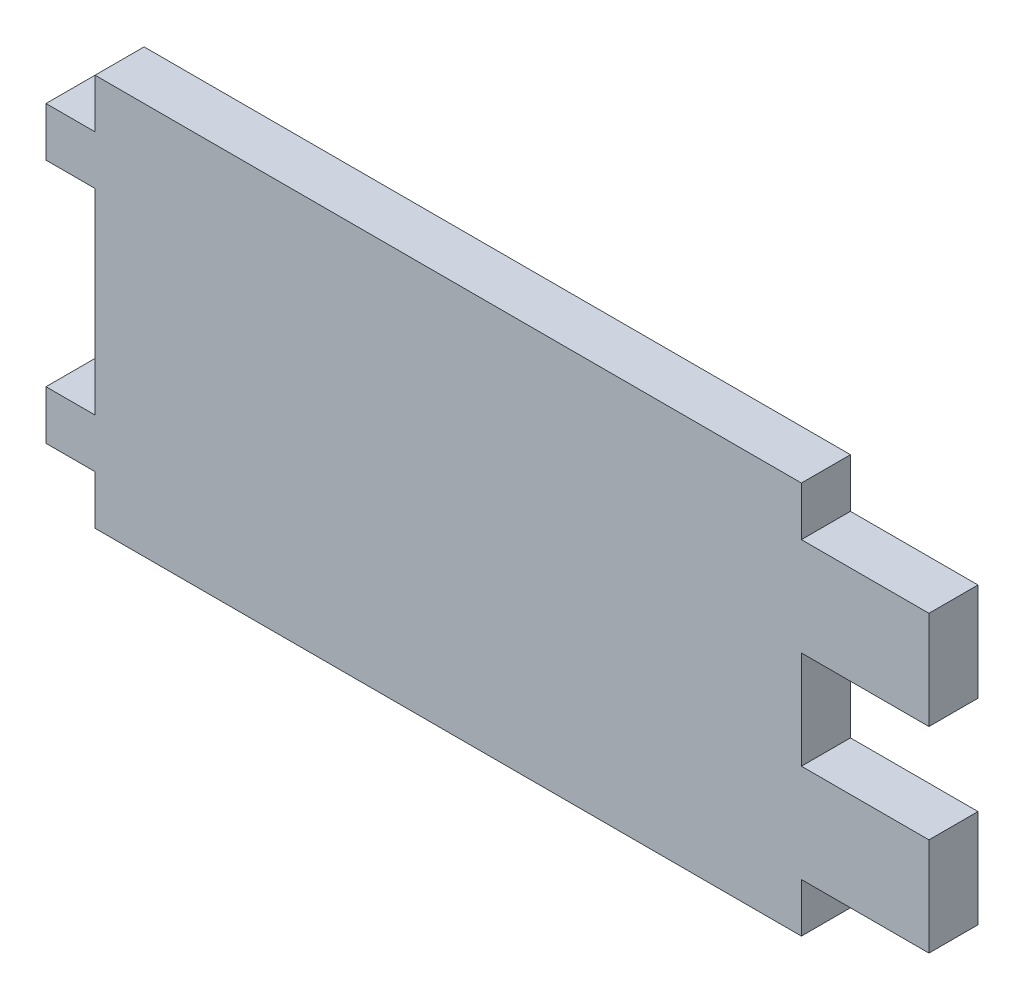
from build123d import *

# Parameters (mm, degrees)
BOSS_EXTRU_1_DEPTH = 5


with BuildPart() as part:
    # Esquisse1 → Boss.-Extru.1 (new body)
    with BuildSketch(Plane.XY):
        Polygon((0, 0), (72, 0), (72, 5), (85, 5), (85, 15), (72, 15), (72, 25), (85, 25), (85, 35), (72, 35), (72, 40), (0, 40), (0, 35), (-5, 35), (-5, 30), (0, 30), (0, 10), (-5, 10), (-5, 5), (0, 5), align=None)
    extrude(amount=BOSS_EXTRU_1_DEPTH)


solid = part.part
